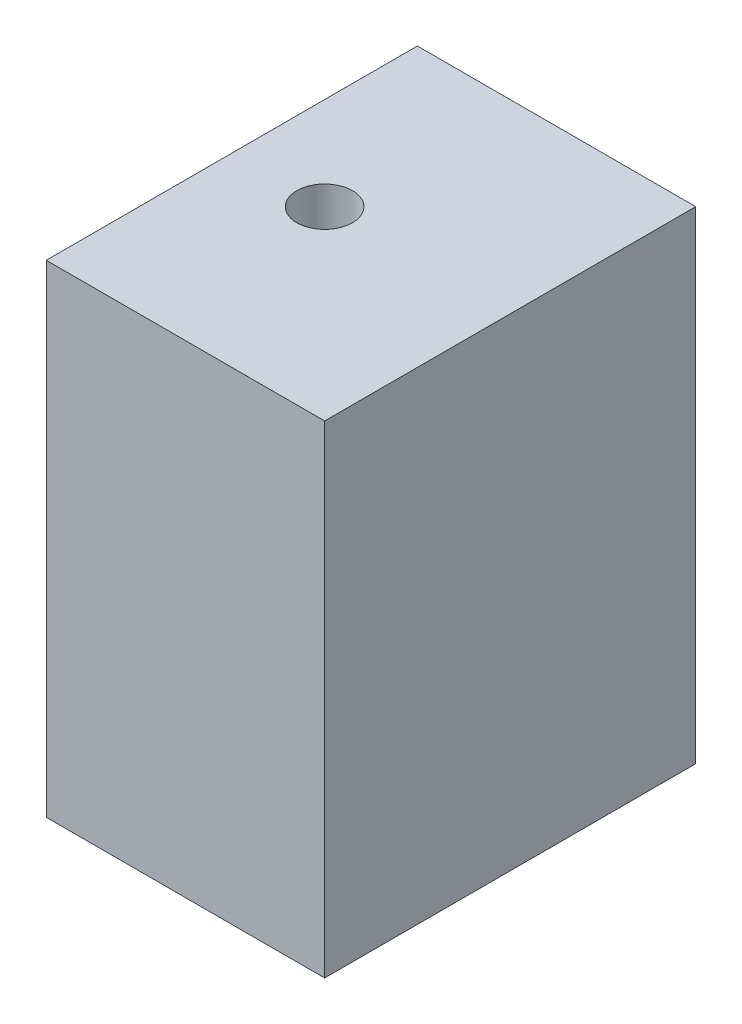
from build123d import *

# Parameters (mm, degrees)
SKETCH_1_W               = 15
SKETCH_1_H               = 20
EXTRUDE_1_DEPTH          = 26
CUT_EXTRUDE_1_DEPTH      = 29.848743474
CUT_EXTRUDE_1_DEPTH_BACK = 29.848743474
SKETCH_3_R               = 1.5


with BuildPart() as part:
    # 草图1 → 凸台-拉伸1 (new body)
    with BuildSketch(Plane(origin=(0, 0, 0), x_dir=(1, 0, 0), z_dir=(0, 1, 0))):
        Rectangle(SKETCH_1_W, SKETCH_1_H)
    extrude(amount=EXTRUDE_1_DEPTH)

    # 草图3 → 切除-拉伸1 (cut, two sides: drawn at the far end of the back side and taken through both)
    with BuildSketch(Plane(origin=(0, 26, 0), x_dir=(1, 0, 0), z_dir=(0, 1, 0)).offset(-CUT_EXTRUDE_1_DEPTH_BACK)):
        with Locations(Location((-2.5, 0, 0), (0, 0, 270))):
            Circle(SKETCH_3_R)
    extrude(amount=CUT_EXTRUDE_1_DEPTH + CUT_EXTRUDE_1_DEPTH_BACK, mode=Mode.SUBTRACT)


solid = part.part
